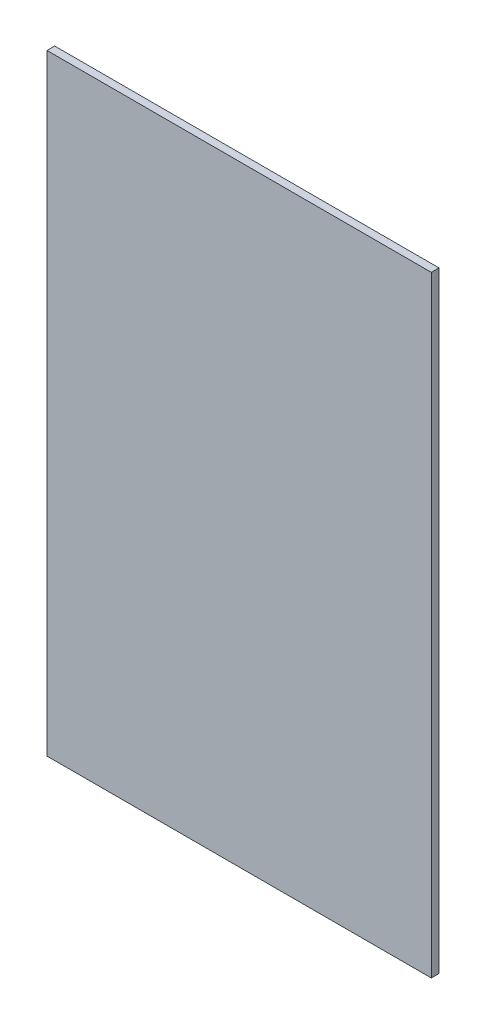
from build123d import *

# Parameters (mm, degrees)
ESQUISSE1_W        = 100
ESQUISSE1_H        = 159
BOSS_EXTRU_1_DEPTH = 2


with BuildPart() as part:
    # Esquisse1 → Boss.-Extru.1 (new body)
    with BuildSketch(Plane.XY):
        Rectangle(ESQUISSE1_W, ESQUISSE1_H)
    extrude(amount=BOSS_EXTRU_1_DEPTH)


solid = part.part
